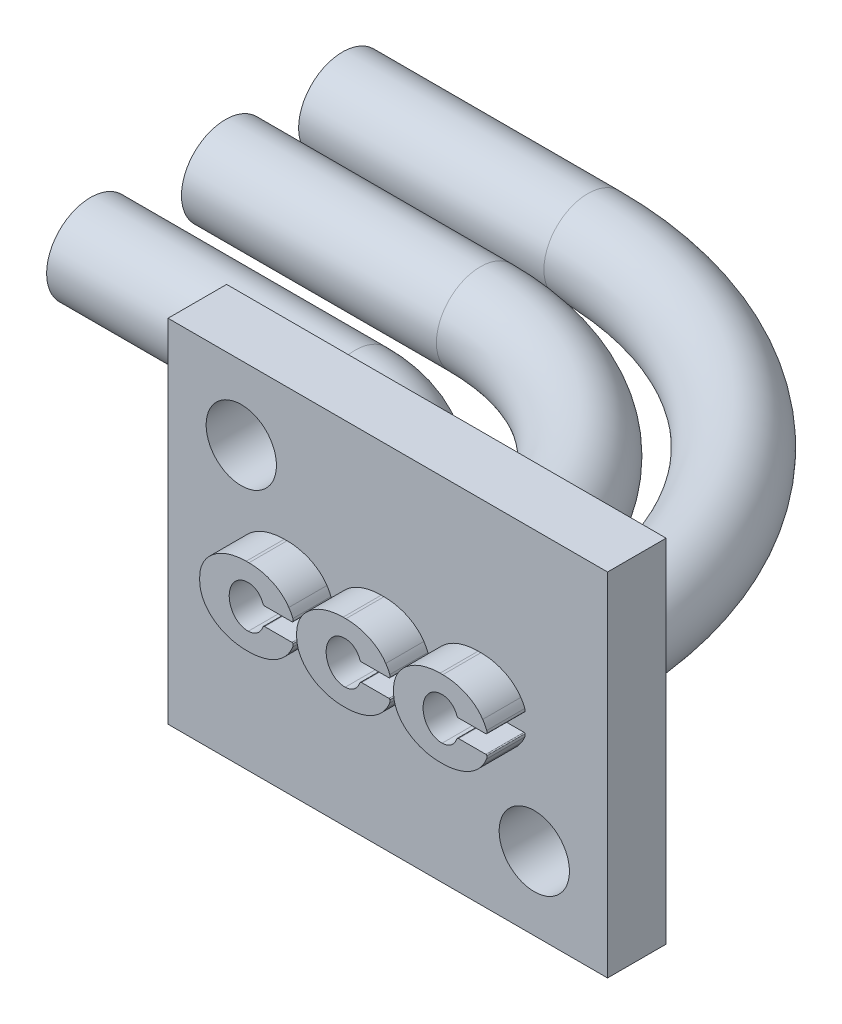
from build123d import *

# Parameters (mm, degrees)
SKETCH1_W           = 15
SKETCH1_H           = 12
BOSS_EXTRUDE1_DEPTH = 2
BOSS_EXTRUDE2_DEPTH = 2
SKETCH3_W           = 1.5
SKETCH3_H           = 4
BOSS_EXTRUDE3_DEPTH = 2
SKETCH12_W          = 14.1
SKETCH12_H          = 8
CUT_EXTRUDE1_DEPTH  = 22.443180832
SKETCH8_R           = 1.5
SKETCH7_R           = 1.5
SKETCH6_R           = 1.5
SKETCH13_R          = 1.2
CUT_EXTRUDE2_DEPTH  = 24.279403135
CUT_EXTRUDE3_START  = -0.7
CUT_EXTRUDE3_DEPTH  = 0.7


with BuildPart() as part:
    # Sketch1 → Boss-Extrude1 (new body)
    with BuildSketch(Plane.XY):
        Rectangle(SKETCH1_W, SKETCH1_H)
    extrude(amount=BOSS_EXTRUDE1_DEPTH)

    # Sketch2 → Boss-Extrude2 (add)
    with BuildSketch(Plane.XY.offset(2)):
        with BuildLine():
            Line((0.407238435, 0.442322853), (1.343073358, 0.442322853))
            ThreePointArc((1.343073358, 0.442322853), (1.361383578, 0.450410651), (1.372317406, 0.467177524))
            ThreePointArc((1.372317406, 0.467177524), (1.375503859, 0.511169305), (1.368128847, 0.554655388))
            ThreePointArc((1.368128847, 0.554655388), (1.307680997, 0.687640629), (1.230966735, 0.811954502))
            add(Edge.make_bspline(
                [(1.230966735, 0.811954502), (0.812669173, 1.453088874), (-0.130132299, 1.453088874)],
                knots=[0.342748392, 0.342748392, 0.342748392, 1.381331695, 1.381331695, 1.381331695], degree=2, weights=[1, 0.868170926, 1]))
            Line((-0.130132299, 1.453088874), (-0.223753352, 1.45308889))
            add(Edge.make_bspline(
                [(-0.223753352, 1.45308889), (-1.809410214, 1.45308889), (-1.809410214, 0.201933814)],
                knots=[4.81203319, 4.81203319, 4.81203319, 6.344970327, 6.344970327, 6.344970327], degree=2, weights=[1, 0.720364542, 1]))
            Line((-1.809410214, 0.201933814), (-1.809410207, 0.071803559))
            add(Edge.make_bspline(
                [(-1.809410207, 0.071803559), (-1.809410207, -1.179351517), (-0.223753345, -1.179351517)],
                knots=[3.079807634, 3.079807634, 3.079807634, 4.612744771, 4.612744771, 4.612744771], degree=2, weights=[1, 0.720364542, 1]))
            Line((-0.223753345, -1.179351517), (-0.130132292, -1.179351553))
            add(Edge.make_bspline(
                [(-0.130132292, -1.179351553), (0.81266918, -1.179351553), (1.230966742, -0.53821718)],
                knots=[1.760260959, 1.760260959, 1.760260959, 2.798844261, 2.798844261, 2.798844261], degree=2, weights=[1, 0.868170926, 1]))
            ThreePointArc((1.230966742, -0.53821718), (1.304716836, -0.419114346), (1.363380807, -0.291901532))
            ThreePointArc((1.363380807, -0.291901532), (1.374973795, -0.243578219), (1.373211686, -0.193915004))
            ThreePointArc((1.373211686, -0.193915004), (1.361207126, -0.172992015), (1.338547111, -0.164721302))
            Line((1.338547111, -0.164721302), (0.407238389, -0.164721302))
            ThreePointArc((0.407238389, -0.164721302), (0.369470559, -0.176722101), (0.34555702, -0.208322271))
            add(Edge.make_bspline(
                [(-0.150934559, -0.579205825), (0.214173352, -0.579565029), (0.34555702, -0.208322271)],
                knots=[5.955155363, 5.955155363, 5.955155363, 7.020735545, 7.020735545, 7.020735545], degree=2, weights=[1, 0.86139323, 1]))
            add(Edge.make_bspline(
                [(-0.210727715, 0.853430346), (-0.832817449, 0.821972711), (-0.802831579, 0.103515223), (-0.77284571, -0.614942265), (-0.150934559, -0.579205825)],
                knots=[3.181025595, 3.181025595, 3.181025595, 4.754799698, 4.754799698, 6.328573801, 6.328573801, 6.328573801], degree=2, weights=[1, 0.706053195, 1, 0.706053195, 1]))
            add(Edge.make_bspline(
                [(0.345557015, 0.485923858), (0.199318189, 0.899141892), (-0.210727715, 0.853430346)],
                knots=[5.545635094, 5.545635094, 5.545635094, 6.707278348, 6.707278348, 6.707278348], degree=2, weights=[1, 0.836012096, 1]))
            ThreePointArc((0.345557015, 0.485923858), (0.369470574, 0.454323662), (0.407238435, 0.442322853))
        make_face()
        with BuildLine():
            Line((-2.901066111, 0.442322853), (-1.965231187, 0.442322853))
            ThreePointArc((-1.965231187, 0.442322853), (-1.946920937, 0.450410638), (-1.935987089, 0.467177524))
            ThreePointArc((-1.935987089, 0.467177524), (-1.932800635, 0.511169305), (-1.940175648, 0.554655388))
            ThreePointArc((-1.940175648, 0.554655388), (-2.000623497, 0.687640629), (-2.077337759, 0.811954502))
            add(Edge.make_bspline(
                [(-2.077337759, 0.811954502), (-2.495635321, 1.453088874), (-3.438436793, 1.453088874)],
                knots=[0.342748392, 0.342748392, 0.342748392, 1.381331695, 1.381331695, 1.381331695], degree=2, weights=[1, 0.868170926, 1]))
            Line((-3.438436793, 1.453088874), (-3.532057847, 1.45308889))
            add(Edge.make_bspline(
                [(-3.532057847, 1.45308889), (-5.117714708, 1.45308889), (-5.117714708, 0.201933814)],
                knots=[4.81203319, 4.81203319, 4.81203319, 6.344970327, 6.344970327, 6.344970327], degree=2, weights=[1, 0.720364542, 1]))
            Line((-5.117714708, 0.201933814), (-5.117714753, 0.071803559))
            add(Edge.make_bspline(
                [(-5.117714753, 0.071803559), (-5.117714753, -1.179351517), (-3.532057891, -1.179351517)],
                knots=[3.079807634, 3.079807634, 3.079807634, 4.612744771, 4.612744771, 4.612744771], degree=2, weights=[1, 0.720364542, 1]))
            Line((-3.532057891, -1.179351517), (-3.438436838, -1.179351553))
            add(Edge.make_bspline(
                [(-3.438436838, -1.179351553), (-2.495635366, -1.179351553), (-2.077337803, -0.53821718)],
                knots=[4.901853612, 4.901853612, 4.901853612, 5.940436915, 5.940436915, 5.940436915], degree=2, weights=[1, 0.868170926, 1]))
            ThreePointArc((-2.077337803, -0.53821718), (-2.003587709, -0.419114346), (-1.944923738, -0.291901532))
            ThreePointArc((-1.944923738, -0.291901532), (-1.933330751, -0.243578219), (-1.935092859, -0.193915004))
            ThreePointArc((-1.935092859, -0.193915004), (-1.94709742, -0.172992015), (-1.969757434, -0.164721302))
            Line((-1.969757434, -0.164721302), (-2.901066156, -0.164721302))
            ThreePointArc((-2.901066156, -0.164721302), (-2.938833986, -0.176722101), (-2.962747525, -0.208322271))
            add(Edge.make_bspline(
                [(-3.459239104, -0.579205825), (-3.094131193, -0.579565029), (-2.962747525, -0.208322271)],
                knots=[2.81356271, 2.81356271, 2.81356271, 3.879142891, 3.879142891, 3.879142891], degree=2, weights=[1, 0.86139323, 1]))
            add(Edge.make_bspline(
                [(-3.51903226, 0.853430346), (-4.141121994, 0.821972711), (-4.111136125, 0.103515223), (-4.081150255, -0.614942265), (-3.459239104, -0.579205825)],
                knots=[0.039432941, 0.039432941, 0.039432941, 1.613207044, 1.613207044, 3.186981147, 3.186981147, 3.186981147], degree=2, weights=[1, 0.706053195, 1, 0.706053195, 1]))
            add(Edge.make_bspline(
                [(-2.962747531, 0.485923858), (-3.108986357, 0.899141892), (-3.51903226, 0.853430346)],
                knots=[5.545635094, 5.545635094, 5.545635094, 6.707278348, 6.707278348, 6.707278348], degree=2, weights=[1, 0.836012096, 1]))
            ThreePointArc((-2.962747531, 0.485923858), (-2.938833971, 0.454323662), (-2.901066111, 0.442322853))
        make_face()
        with BuildLine():
            Line((3.715542981, 0.442322853), (4.651377904, 0.442322853))
            ThreePointArc((4.651377904, 0.442322853), (4.669688124, 0.450410651), (4.680621952, 0.467177524))
            ThreePointArc((4.680621952, 0.467177524), (4.683808405, 0.511169305), (4.676433393, 0.554655388))
            ThreePointArc((4.676433393, 0.554655388), (4.615985543, 0.687640629), (4.539271281, 0.811954502))
            add(Edge.make_bspline(
                [(4.539271281, 0.811954502), (4.120973719, 1.453088874), (3.178172247, 1.453088874)],
                knots=[0.342748392, 0.342748392, 0.342748392, 1.381331695, 1.381331695, 1.381331695], degree=2, weights=[1, 0.868170926, 1]))
            Line((3.178172247, 1.453088874), (3.084551194, 1.45308889))
            add(Edge.make_bspline(
                [(3.084551194, 1.45308889), (1.498894332, 1.45308889), (1.498894332, 0.201933814)],
                knots=[4.81203319, 4.81203319, 4.81203319, 6.344970327, 6.344970327, 6.344970327], degree=2, weights=[1, 0.720364542, 1]))
            Line((1.498894332, 0.201933814), (1.498894339, 0.071803559))
            add(Edge.make_bspline(
                [(1.498894339, 0.071803559), (1.498894339, -1.179351517), (3.084551201, -1.179351517)],
                knots=[3.079807634, 3.079807634, 3.079807634, 4.612744771, 4.612744771, 4.612744771], degree=2, weights=[1, 0.720364542, 1]))
            Line((3.084551201, -1.179351517), (3.178172254, -1.179351553))
            add(Edge.make_bspline(
                [(3.178172254, -1.179351553), (4.120973726, -1.179351553), (4.539271288, -0.53821718)],
                knots=[1.760260959, 1.760260959, 1.760260959, 2.798844261, 2.798844261, 2.798844261], degree=2, weights=[1, 0.868170926, 1]))
            ThreePointArc((4.539271288, -0.53821718), (4.613021382, -0.419114346), (4.671685353, -0.291901532))
            ThreePointArc((4.671685353, -0.291901532), (4.683278341, -0.243578219), (4.681516232, -0.193915004))
            ThreePointArc((4.681516232, -0.193915004), (4.669511672, -0.172992015), (4.646851657, -0.164721302))
            Line((4.646851657, -0.164721302), (3.715542935, -0.164721302))
            ThreePointArc((3.715542935, -0.164721302), (3.677775105, -0.176722101), (3.653861566, -0.208322271))
            add(Edge.make_bspline(
                [(3.157369987, -0.579205825), (3.522477898, -0.579565029), (3.653861566, -0.208322271)],
                knots=[5.955155363, 5.955155363, 5.955155363, 7.020735545, 7.020735545, 7.020735545], degree=2, weights=[1, 0.86139323, 1]))
            add(Edge.make_bspline(
                [(3.097576831, 0.853430346), (2.475487097, 0.821972711), (2.505472967, 0.103515223), (2.535458836, -0.614942265), (3.157369987, -0.579205825)],
                knots=[3.181025595, 3.181025595, 3.181025595, 4.754799698, 4.754799698, 6.328573801, 6.328573801, 6.328573801], degree=2, weights=[1, 0.706053195, 1, 0.706053195, 1]))
            add(Edge.make_bspline(
                [(3.653861561, 0.485923858), (3.507622735, 0.899141892), (3.097576831, 0.853430346)],
                knots=[5.545635094, 5.545635094, 5.545635094, 6.707278348, 6.707278348, 6.707278348], degree=2, weights=[1, 0.836012096, 1]))
            ThreePointArc((3.653861561, 0.485923858), (3.67777512, 0.454323662), (3.715542981, 0.442322853))
        make_face()
    extrude(amount=BOSS_EXTRUDE2_DEPTH)

    # Sketch3 → Boss-Extrude3 (add, symmetric)
    with BuildSketch(Plane(origin=(0, 0, 0), x_dir=(1, 0, 0), z_dir=(0, 1, 0))):
        Polygon((2.72873188, 0), (4.22873188, 0), (4.22873188, 14.1), (-2.422646748, 14.1), (-2.422646748, 12.6), (2.72873188, 12.6), align=None)
        with Locations((-3.864025386, 2)):
            Rectangle(SKETCH3_W, SKETCH3_H)
        Polygon((-0.942646753, 0), (0.557353247, 0), (0.557353247, 10.1), (-2.642646753, 10.1), (-2.642646753, 8.6), (-0.942646753, 8.6), align=None)
    extrude(amount=BOSS_EXTRUDE3_DEPTH, both=True)

    # Sketch12 → Cut-Extrude1 (cut, through all)
    with BuildSketch(Plane(origin=(7.5, 0, 0), x_dir=(0, 0, -1), z_dir=(1, 0, 0))):
        with Locations((7.05, -2)):
            Rectangle(SKETCH12_W, SKETCH12_H)
    extrude(amount=-CUT_EXTRUDE1_DEPTH, mode=Mode.SUBTRACT)

    # Sweep1: sweep along a path in Sketch9
    with BuildLine(Plane(origin=(0, 0, 0), x_dir=(1, 0, 0), z_dir=(0, 1, 0))) as sweep1_path:
        Line((-3.864025386, 0), (-3.864025386, 0.75))
        ThreePointArc((-3.864025386, 0.75), (-5.035598261, 3.578427125), (-7.864025386, 4.75))
        Line((-7.864025386, 4.75), (-16.894025386, 4.75))
    # Sketch8 → Sweep1 (sweep)
    with BuildSketch(Plane(origin=(0, 0, 0), x_dir=(-1, 0, 0), z_dir=(0, 0, -1))):
        with Locations((3.864025386, 0)):
            Circle(SKETCH8_R)
    sweep(path=sweep1_path.line)

    # Sweep2: sweep along a path in Sketch10
    with BuildLine(Plane(origin=(0, 0, 0), x_dir=(1, 0, 0), z_dir=(0, 1, 0))) as sweep2_path:
        Line((-0.192646753, 0), (-0.192646753, 1.16))
        ThreePointArc((-0.192646753, 1.16), (-2.535792503, 6.816854249), (-8.192646753, 9.16))
        Line((-8.192646753, 9.16), (-16.894025753, 9.16))
    # Sketch7 → Sweep2 (sweep)
    with BuildSketch(Plane(origin=(0, 0, 0), x_dir=(-1, 0, 0), z_dir=(0, 0, -1))):
        Circle(SKETCH7_R)
    sweep(path=sweep2_path.line)

    # Sweep3: sweep along a path in Sketch11
    with BuildLine(Plane(origin=(0, 0, 0), x_dir=(1, 0, 0), z_dir=(0, 1, 0))) as sweep3_path:
        Line((3.47873188, 0), (3.47873188, 1.35))
        ThreePointArc((3.47873188, 1.35), (-0.035986746, 9.835281374), (-8.52126812, 13.35))
        Line((-8.52126812, 13.35), (-16.89402512, 13.35))
    # Sketch6 → Sweep3 (sweep)
    with BuildSketch(Plane(origin=(0, 0, 0), x_dir=(-1, 0, 0), z_dir=(0, 0, -1))):
        with Locations((-3.47873188, 0)):
            Circle(SKETCH6_R)
    sweep(path=sweep3_path.line)

    # Sketch13 → Cut-Extrude2 (cut, through all)
    with BuildSketch(Plane(origin=(0, 0, 0), x_dir=(-1, 0, 0), z_dir=(0, 0, -1))):
        with Locations((-5, -3.5)):
            Circle(SKETCH13_R)
        with Locations((5, 3.5)):
            Circle(SKETCH13_R)
    extrude(amount=-CUT_EXTRUDE2_DEPTH, mode=Mode.SUBTRACT)

    # Sketch15 → Cut-Extrude3 (cut)
    with BuildSketch(Plane.XY.offset(4).offset(CUT_EXTRUDE3_START)):
        with BuildLine():
            Line((-2.901066111, 0.442322853), (-1.965231187, 0.442322853))
            ThreePointArc((-1.965231187, 0.442322853), (-1.946920937, 0.450410638), (-1.935987089, 0.467177524))
            ThreePointArc((-1.935987089, 0.467177524), (-1.932800635, 0.511169305), (-1.940175648, 0.554655388))
            ThreePointArc((-1.940175648, 0.554655388), (-2.000623497, 0.687640629), (-2.077337759, 0.811954502))
            add(Edge.make_bspline(
                [(-2.077337759, 0.811954502), (-2.495635321, 1.453088874), (-3.438436793, 1.453088874)],
                knots=[3.484341046, 3.484341046, 3.484341046, 4.522924348, 4.522924348, 4.522924348], degree=2, weights=[1, 0.868170926, 1]))
            Line((-3.438436793, 1.453088874), (-3.532057847, 1.45308889))
            add(Edge.make_bspline(
                [(-3.532057847, 1.45308889), (-5.117714708, 1.45308889), (-5.117714708, 0.201933814)],
                knots=[4.81203319, 4.81203319, 4.81203319, 6.344970327, 6.344970327, 6.344970327], degree=2, weights=[1, 0.720364542, 1]))
            Line((-5.117714708, 0.201933814), (-5.117714753, 0.071803559))
            add(Edge.make_bspline(
                [(-5.117714753, 0.071803559), (-5.117714753, -1.179351517), (-3.532057891, -1.179351517)],
                knots=[3.079807634, 3.079807634, 3.079807634, 4.612744771, 4.612744771, 4.612744771], degree=2, weights=[1, 0.720364542, 1]))
            Line((-3.532057891, -1.179351517), (-3.438436838, -1.179351553))
            add(Edge.make_bspline(
                [(-3.438436838, -1.179351553), (-2.495635366, -1.179351553), (-2.077337803, -0.53821718)],
                knots=[1.760260959, 1.760260959, 1.760260959, 2.798844261, 2.798844261, 2.798844261], degree=2, weights=[1, 0.868170926, 1]))
            ThreePointArc((-2.077337803, -0.53821718), (-2.003587709, -0.419114346), (-1.944923738, -0.291901532))
            ThreePointArc((-1.944923738, -0.291901532), (-1.933330751, -0.243578219), (-1.935092859, -0.193915004))
            ThreePointArc((-1.935092859, -0.193915004), (-1.94709742, -0.172992015), (-1.969757434, -0.164721302))
            Line((-1.969757434, -0.164721302), (-2.901066156, -0.164721302))
            ThreePointArc((-2.901066156, -0.164721302), (-2.938833986, -0.176722101), (-2.962747525, -0.208322271))
            add(Edge.make_bspline(
                [(-3.459239104, -0.579205825), (-3.094131193, -0.579565029), (-2.962747525, -0.208322271)],
                knots=[5.955155363, 5.955155363, 5.955155363, 7.020735545, 7.020735545, 7.020735545], degree=2, weights=[1, 0.86139323, 1]))
            add(Edge.make_bspline(
                [(-3.51903226, 0.853430346), (-4.141121994, 0.821972711), (-4.111136125, 0.103515223), (-4.081150255, -0.614942265), (-3.459239104, -0.579205825)],
                knots=[3.181025595, 3.181025595, 3.181025595, 4.754799698, 4.754799698, 6.328573801, 6.328573801, 6.328573801], degree=2, weights=[1, 0.706053195, 1, 0.706053195, 1]))
            add(Edge.make_bspline(
                [(-2.962747531, 0.485923858), (-3.108986357, 0.899141892), (-3.51903226, 0.853430346)],
                knots=[2.40404244, 2.40404244, 2.40404244, 3.565685694, 3.565685694, 3.565685694], degree=2, weights=[1, 0.836012096, 1]))
            ThreePointArc((-2.962747531, 0.485923858), (-2.938833971, 0.454323662), (-2.901066111, 0.442322853))
        make_face()
        with BuildLine():
            Line((0.407238435, 0.442322853), (1.343073358, 0.442322853))
            ThreePointArc((1.343073358, 0.442322853), (1.361383578, 0.450410651), (1.372317406, 0.467177524))
            ThreePointArc((1.372317406, 0.467177524), (1.375503859, 0.511169305), (1.368128847, 0.554655388))
            ThreePointArc((1.368128847, 0.554655388), (1.307680997, 0.687640629), (1.230966735, 0.811954502))
            add(Edge.make_bspline(
                [(1.230966735, 0.811954502), (0.812669173, 1.453088874), (-0.130132299, 1.453088874)],
                knots=[0.342748392, 0.342748392, 0.342748392, 1.381331695, 1.381331695, 1.381331695], degree=2, weights=[1, 0.868170926, 1]))
            Line((-0.130132299, 1.453088874), (-0.223753352, 1.45308889))
            add(Edge.make_bspline(
                [(-0.223753352, 1.45308889), (-1.809410214, 1.45308889), (-1.809410214, 0.201933814)],
                knots=[4.81203319, 4.81203319, 4.81203319, 6.344970327, 6.344970327, 6.344970327], degree=2, weights=[1, 0.720364542, 1]))
            Line((-1.809410214, 0.201933814), (-1.809410207, 0.071803559))
            add(Edge.make_bspline(
                [(-1.809410207, 0.071803559), (-1.809410207, -1.179351517), (-0.223753345, -1.179351517)],
                knots=[3.079807634, 3.079807634, 3.079807634, 4.612744771, 4.612744771, 4.612744771], degree=2, weights=[1, 0.720364542, 1]))
            Line((-0.223753345, -1.179351517), (-0.130132292, -1.179351553))
            add(Edge.make_bspline(
                [(-0.130132292, -1.179351553), (0.81266918, -1.179351553), (1.230966742, -0.53821718)],
                knots=[1.760260959, 1.760260959, 1.760260959, 2.798844261, 2.798844261, 2.798844261], degree=2, weights=[1, 0.868170926, 1]))
            ThreePointArc((1.230966742, -0.53821718), (1.304716836, -0.419114346), (1.363380807, -0.291901532))
            ThreePointArc((1.363380807, -0.291901532), (1.374973795, -0.243578219), (1.373211686, -0.193915004))
            ThreePointArc((1.373211686, -0.193915004), (1.361207126, -0.172992015), (1.338547111, -0.164721302))
            Line((1.338547111, -0.164721302), (0.407238389, -0.164721302))
            ThreePointArc((0.407238389, -0.164721302), (0.369470559, -0.176722101), (0.34555702, -0.208322271))
            add(Edge.make_bspline(
                [(-0.150934559, -0.579205825), (0.214173352, -0.579565029), (0.34555702, -0.208322271)],
                knots=[5.955155363, 5.955155363, 5.955155363, 7.020735545, 7.020735545, 7.020735545], degree=2, weights=[1, 0.86139323, 1]))
            add(Edge.make_bspline(
                [(-0.210727715, 0.853430346), (-0.832817449, 0.821972711), (-0.802831579, 0.103515223), (-0.77284571, -0.614942265), (-0.150934559, -0.579205825)],
                knots=[3.181025595, 3.181025595, 3.181025595, 4.754799698, 4.754799698, 6.328573801, 6.328573801, 6.328573801], degree=2, weights=[1, 0.706053195, 1, 0.706053195, 1]))
            add(Edge.make_bspline(
                [(0.345557015, 0.485923858), (0.199318189, 0.899141892), (-0.210727715, 0.853430346)],
                knots=[2.404042441, 2.404042441, 2.404042441, 3.565685694, 3.565685694, 3.565685694], degree=2, weights=[1, 0.836012096, 1]))
            ThreePointArc((0.345557015, 0.485923858), (0.369470574, 0.454323662), (0.407238435, 0.442322853))
        make_face()
        with BuildLine():
            Line((3.715542981, 0.442322853), (4.651377904, 0.442322853))
            ThreePointArc((4.651377904, 0.442322853), (4.669688124, 0.450410651), (4.680621952, 0.467177524))
            ThreePointArc((4.680621952, 0.467177524), (4.683808405, 0.511169305), (4.676433393, 0.554655388))
            ThreePointArc((4.676433393, 0.554655388), (4.615985543, 0.687640629), (4.539271281, 0.811954502))
            add(Edge.make_bspline(
                [(4.539271281, 0.811954502), (4.120973719, 1.453088874), (3.178172247, 1.453088874)],
                knots=[0.342748392, 0.342748392, 0.342748392, 1.381331695, 1.381331695, 1.381331695], degree=2, weights=[1, 0.868170926, 1]))
            Line((3.178172247, 1.453088874), (3.084551194, 1.45308889))
            add(Edge.make_bspline(
                [(3.084551194, 1.45308889), (1.498894332, 1.45308889), (1.498894332, 0.201933814)],
                knots=[1.670440536, 1.670440536, 1.670440536, 3.203377674, 3.203377674, 3.203377674], degree=2, weights=[1, 0.720364542, 1]))
            Line((1.498894332, 0.201933814), (1.498894339, 0.071803559))
            add(Edge.make_bspline(
                [(1.498894339, 0.071803559), (1.498894339, -1.179351517), (3.084551201, -1.179351517)],
                knots=[3.079807634, 3.079807634, 3.079807634, 4.612744771, 4.612744771, 4.612744771], degree=2, weights=[1, 0.720364542, 1]))
            Line((3.084551201, -1.179351517), (3.178172254, -1.179351553))
            add(Edge.make_bspline(
                [(3.178172254, -1.179351553), (4.120973726, -1.179351553), (4.539271288, -0.53821718)],
                knots=[1.760260959, 1.760260959, 1.760260959, 2.798844261, 2.798844261, 2.798844261], degree=2, weights=[1, 0.868170926, 1]))
            ThreePointArc((4.539271288, -0.53821718), (4.613021382, -0.419114346), (4.671685353, -0.291901532))
            ThreePointArc((4.671685353, -0.291901532), (4.683278341, -0.243578219), (4.681516232, -0.193915004))
            ThreePointArc((4.681516232, -0.193915004), (4.669511672, -0.172992015), (4.646851657, -0.164721302))
            Line((4.646851657, -0.164721302), (3.715542935, -0.164721302))
            ThreePointArc((3.715542935, -0.164721302), (3.677775105, -0.176722101), (3.653861566, -0.208322271))
            add(Edge.make_bspline(
                [(3.157369987, -0.579205825), (3.522477898, -0.579565029), (3.653861566, -0.208322271)],
                knots=[5.955155363, 5.955155363, 5.955155363, 7.020735545, 7.020735545, 7.020735545], degree=2, weights=[1, 0.86139323, 1]))
            add(Edge.make_bspline(
                [(3.097576831, 0.853430346), (2.475487097, 0.821972711), (2.505472967, 0.103515223), (2.535458836, -0.614942265), (3.157369987, -0.579205825)],
                knots=[3.181025595, 3.181025595, 3.181025595, 4.754799698, 4.754799698, 6.328573801, 6.328573801, 6.328573801], degree=2, weights=[1, 0.706053195, 1, 0.706053195, 1]))
            add(Edge.make_bspline(
                [(3.653861561, 0.485923858), (3.507622735, 0.899141892), (3.097576831, 0.853430346)],
                knots=[2.404042441, 2.404042441, 2.404042441, 3.565685694, 3.565685694, 3.565685694], degree=2, weights=[1, 0.836012096, 1]))
            ThreePointArc((3.653861561, 0.485923858), (3.67777512, 0.454323662), (3.715542981, 0.442322853))
        make_face()
    extrude(amount=CUT_EXTRUDE3_DEPTH, mode=Mode.SUBTRACT)


solid = part.part
